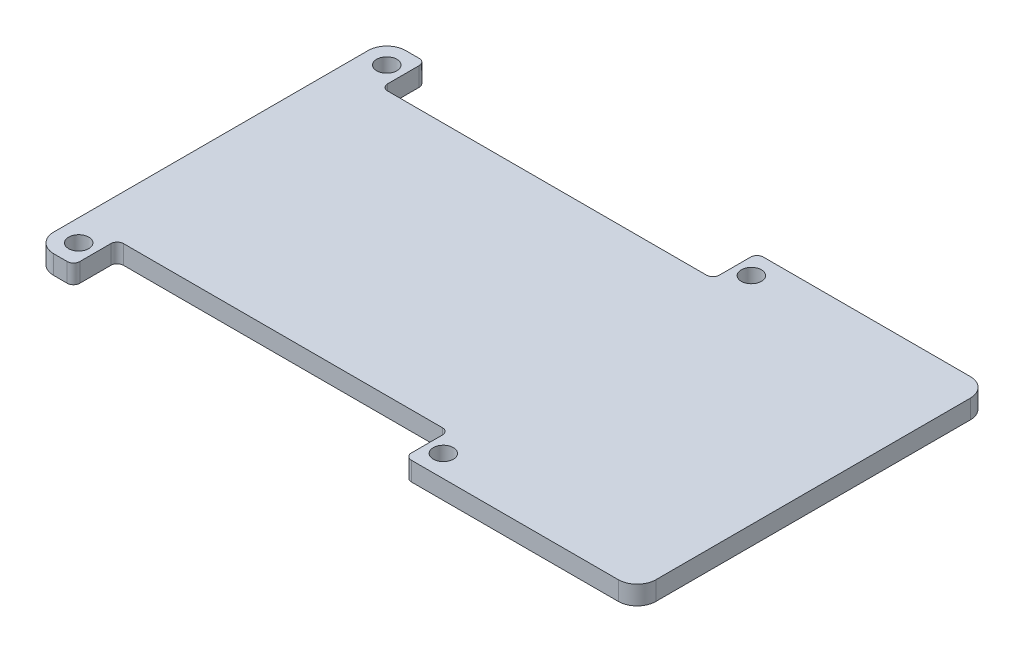
from build123d import *

# Parameters (mm, degrees)
SKETCH_1_R      = 1.6
EXTRUDE_1_DEPTH = 3


with BuildPart() as part:
    # 草图1 → 凸台-拉伸1 (new body)
    with BuildSketch(Plane(origin=(0, 0, 0), x_dir=(1, 0, 0), z_dir=(0, 1, 0))):
        with BuildLine():
            Line((-21.134628196, 23.389975432), (-21.134628196, 18.377736005))
            ThreePointArc((-21.134628196, 18.377736005), (-21.427521415, 17.670629223), (-22.134628196, 17.377736005))
            Line((-22.134628196, 17.377736005), (-72.874730915, 17.377736005))
            ThreePointArc((-72.874730915, 17.377736005), (-73.581837696, 17.670629223), (-73.874730915, 18.377736005))
            Line((-73.874730915, 18.377736005), (-73.874730915, 23.389975432))
            ThreePointArc((-73.874730915, 23.389975432), (-74.167624134, 24.097082213), (-74.874730915, 24.389975432))
            Line((-74.874730915, 24.389975432), (-77.021723127, 24.389975432))
            ThreePointArc((-77.021723127, 24.389975432), (-79.134066788, 23.515014039), (-80.009028181, 21.402670377))
            Line((-80.009028181, 21.402670377), (-80.009028181, -28.604431477))
            ThreePointArc((-80.009028181, -28.604431477), (-79.134066788, -30.716775138), (-77.021723127, -31.591736531))
            Line((-77.021723127, -31.591736531), (-74.874730915, -31.591736531))
            ThreePointArc((-74.874730915, -31.591736531), (-74.167624134, -31.298843313), (-73.874730915, -30.591736531))
            Line((-73.874730915, -30.591736531), (-73.874730915, -25.64502865))
            ThreePointArc((-73.874730915, -25.64502865), (-73.581837696, -24.937921869), (-72.874730915, -24.64502865))
            Line((-72.874730915, -24.64502865), (-22.134628196, -24.64502865))
            ThreePointArc((-22.134628196, -24.64502865), (-21.427521415, -24.937921869), (-21.134628196, -25.64502865))
            Line((-21.134628196, -25.64502865), (-21.134628196, -30.591736531))
            ThreePointArc((-21.134628196, -30.591736531), (-20.841734977, -31.298843313), (-20.134628196, -31.591736531))
            Line((-20.134628196, -31.591736531), (12.787258331, -31.591736531))
            ThreePointArc((12.787258331, -31.591736531), (14.899601993, -30.716775138), (15.774563386, -28.604431477))
            Line((15.774563386, -28.604431477), (15.774563386, 21.402670377))
            ThreePointArc((15.774563386, 21.402670377), (14.899601993, 23.515014039), (12.787258331, 24.389975432))
            Line((12.787258331, 24.389975432), (-20.134628196, 24.389975432))
            ThreePointArc((-20.134628196, 24.389975432), (-20.841734977, 24.097082213), (-21.134628196, 23.389975432))
        make_face()
        with Locations(Location((-76.52848462, 20.886724226, 0), (0, 0, 270))):
            Circle(SKETCH_1_R, mode=Mode.SUBTRACT)
        with Locations(Location((-18.52858622, 20.886597225, 0), (0, 0, 270))):
            Circle(SKETCH_1_R, mode=Mode.SUBTRACT)
        with Locations(Location((-18.52833222, -28.113656775, 0), (0, 0, 270))):
            Circle(SKETCH_1_R, mode=Mode.SUBTRACT)
        with Locations(Location((-76.52833222, -28.113529775, 0), (0, 0, 270))):
            Circle(SKETCH_1_R, mode=Mode.SUBTRACT)
    extrude(amount=EXTRUDE_1_DEPTH)


solid = part.part
